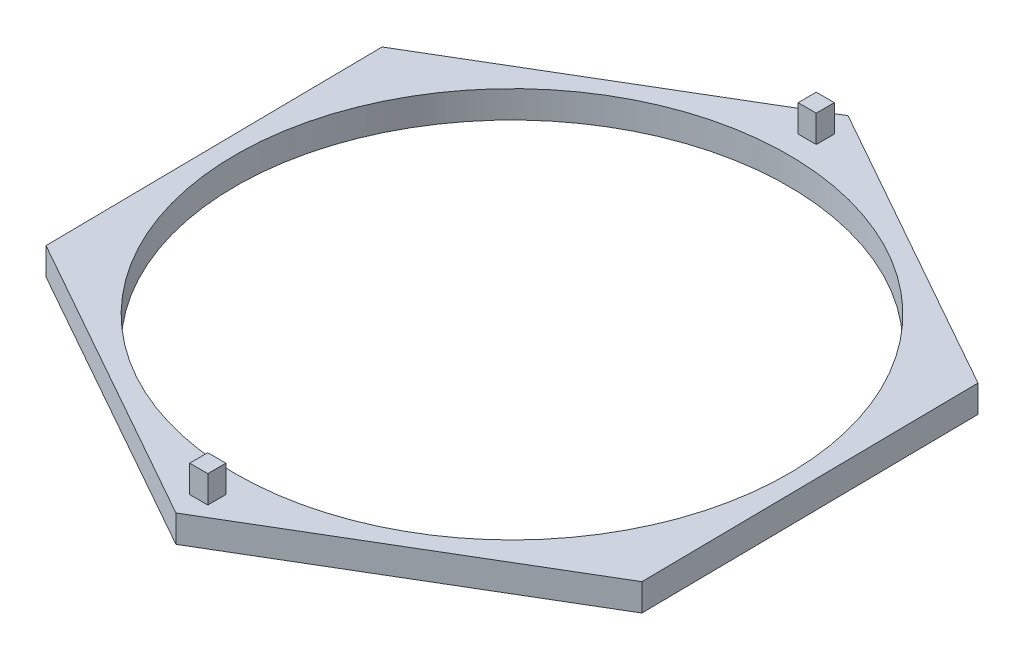
from build123d import *

# Parameters (mm, degrees)
BOSS_EXTRUDE1_DEPTH = 3
SKETCH2_R           = 30.5
CUT_EXTRUDE1_DEPTH  = 50.876169719
SKETCH3_W           = 2
SKETCH3_H           = 2
BOSS_EXTRUDE2_DEPTH = 3
SKETCH4_W           = 2
SKETCH4_H           = 2
BOSS_EXTRUDE3_DEPTH = 3


with BuildPart() as part:
    # Sketch1 → Boss-Extrude1 (new body)
    with BuildSketch(Plane(origin=(0, 0, 0), x_dir=(1, 0, 0), z_dir=(0, 1, 0))):
        Polygon((-32.718400228, 18.380414028), (-32.277105594, -19.144758755), (0.441294634, -37.525172783), (32.718400228, -18.380414028), (32.277105594, 19.144758755), (-0.441294634, 37.525172783), align=None)
    extrude(amount=BOSS_EXTRUDE1_DEPTH)

    # Sketch2 → Cut-Extrude1 (cut, through all)
    with BuildSketch(Plane(origin=(0, 3, 0), x_dir=(1, 0, 0), z_dir=(0, 1, 0))):
        with Locations(Location((0, 0, 0), (0, 0, 270))):
            Circle(SKETCH2_R)
    extrude(amount=-CUT_EXTRUDE1_DEPTH, mode=Mode.SUBTRACT)

    # Sketch3 → Boss-Extrude2 (add)
    with BuildSketch(Plane(origin=(0, 3, 0), x_dir=(1, 0, 0), z_dir=(0, 1, 0))):
        with Locations((-0.441294634, 34.010990071)):
            Rectangle(SKETCH3_W, SKETCH3_H)
    extrude(amount=BOSS_EXTRUDE2_DEPTH)

    # Sketch4 → Boss-Extrude3 (add)
    with BuildSketch(Plane(origin=(0, 3, 0), x_dir=(1, 0, 0), z_dir=(0, 1, 0))):
        with Locations((0.441294634, -34.010990071)):
            Rectangle(SKETCH4_W, SKETCH4_H)
    extrude(amount=BOSS_EXTRUDE3_DEPTH)


solid = part.part
